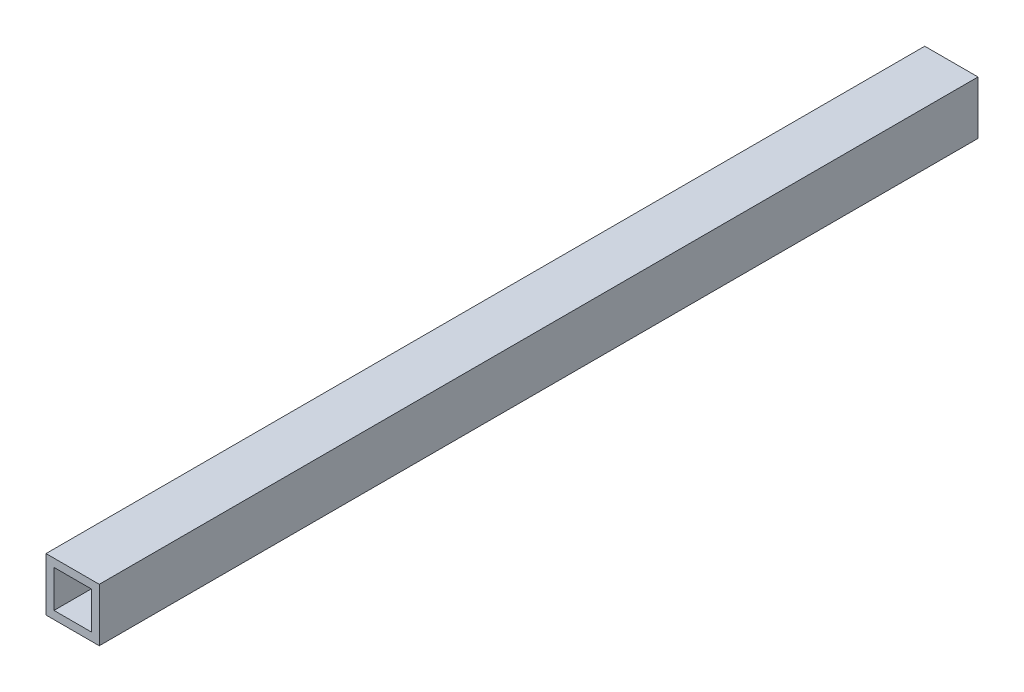
from build123d import *

# Parameters (mm, degrees)
SKETCH_1_W      = 10
SKETCH_1_H      = 10
SKETCH_1_W_2    = 7
SKETCH_1_H_2    = 7
EXTRUDE_1_DEPTH = 165


with BuildPart() as part:
    # 草图1 → 凸台-拉伸1 (new body)
    with BuildSketch(Plane.XY):
        Rectangle(SKETCH_1_W, SKETCH_1_H)
        Rectangle(SKETCH_1_W_2, SKETCH_1_H_2, mode=Mode.SUBTRACT)
    extrude(amount=EXTRUDE_1_DEPTH)


solid = part.part
